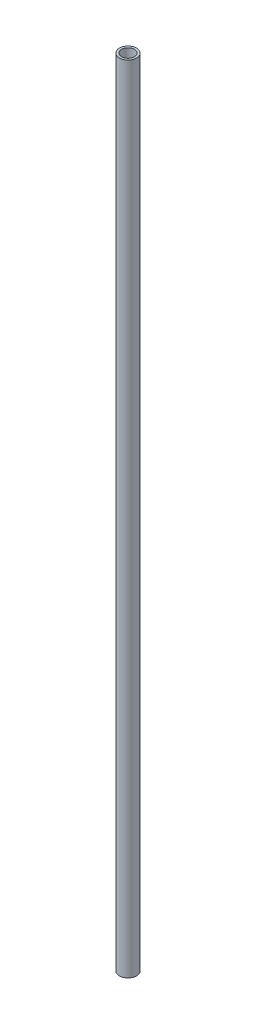
from build123d import *

# Parameters (mm, degrees)
SKETCH1_R           = 4
SKETCH1_R_2         = 3
BOSS_EXTRUDE1_DEPTH = 370


with BuildPart() as part:
    # Sketch1 → Boss-Extrude1 (new body)
    with BuildSketch(Plane(origin=(0, 0, 0), x_dir=(1, 0, 0), z_dir=(0, 1, 0))):
        with Locations(Location((0, 0, 0), (0, 0, 270))):
            Circle(SKETCH1_R)
        with Locations(Location((0, 0, 0), (0, 0, 270))):
            Circle(SKETCH1_R_2, mode=Mode.SUBTRACT)
    extrude(amount=BOSS_EXTRUDE1_DEPTH)


solid = part.part
